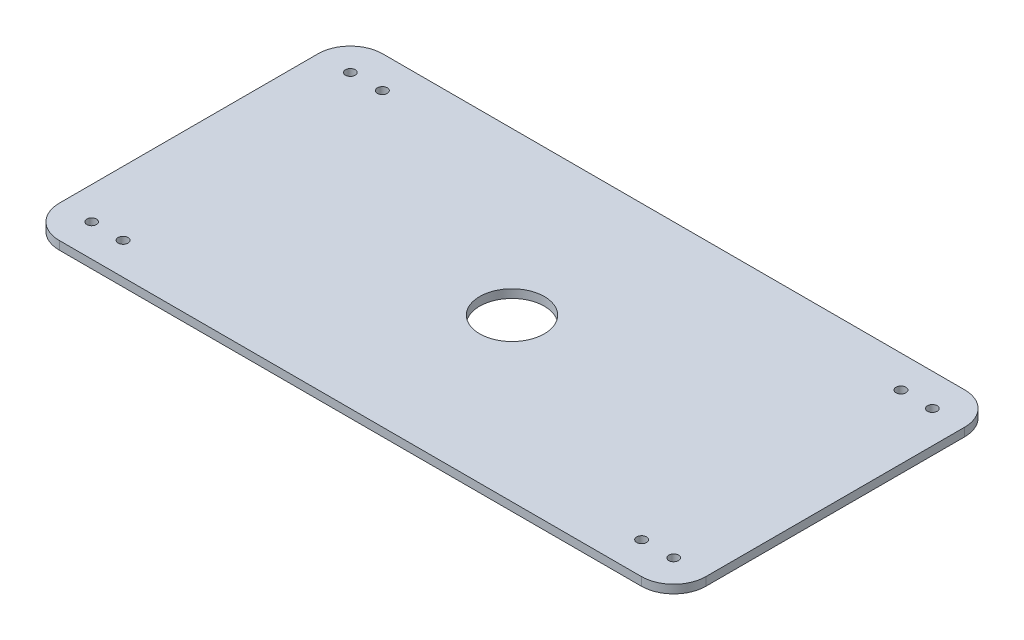
from build123d import *

# Parameters (mm, degrees)
SKETCH1_W               = 200
SKETCH1_H               = 100
BOSS_EXTRUDE1_DEPTH     = 2.6
FILLET1_R               = 10
SKETCH6_R               = 1.5
CUT_EXTRUDE6_DEPTH      = 2.6
MIRROR6_COPY_1_SKETCH_R = 1.5
MIRROR6_COPY_1_DEPTH    = 2.6
SKETCH15_R              = 10
CUT_EXTRUDE14_DEPTH     = 224.621913059
SKETCH23_R              = 1.524
CUT_EXTRUDE16_DEPTH     = 2.59999988
MIRROR8_COPY_1_SKETCH_R = 1.524
MIRROR8_COPY_1_DEPTH    = 2.59999988


with BuildPart() as part:
    # Sketch1 → Boss-Extrude1 (new body)
    with BuildSketch(Plane(origin=(0, 0, 0), x_dir=(1, 0, 0), z_dir=(0, 1, 0))):
        with Locations((100, -50)):
            Rectangle(SKETCH1_W, SKETCH1_H)
    extrude(amount=BOSS_EXTRUDE1_DEPTH)

    # Fillet1
    fillet1_edges = [part.edges().sort_by_distance(p)[0] for p in [
        (0, 1.3, 0),
        (200, 1.3, 0),
        (200, 1.3, 100),
        (0, 1.3, 100),
    ]]
    fillet(fillet1_edges, radius=FILLET1_R)

    # Sketch6 → Cut-Extrude6 (cut)
    with BuildSketch(Plane.XZ):
        with Locations(Location((190, 10, 0), (0, 0, 270))):
            Circle(SKETCH6_R)
    cut_extrude6 = extrude(amount=-CUT_EXTRUDE6_DEPTH, mode=Mode.SUBTRACT)

    # Mirror5: Cut-Extrude6 across plane
    add(cut_extrude6.mirror(Plane(origin=(100, 0, 0), x_dir=(0, 0, 1), z_dir=(1, 0, 0))), mode=Mode.SUBTRACT)

    # Mirror6: Cut-Extrude6 across plane
    add(cut_extrude6.mirror(Plane.XY.offset(50)), mode=Mode.SUBTRACT)

    # Mirror6 copy 1 sketch → Mirror6 copy 1 (cut)
    with BuildSketch(Plane(origin=(200, 0, 100), x_dir=(-1, 0, 0), z_dir=(0, -1, 0))):
        with Locations(Location((190, 10, 0), (0, 0, 270))):
            Circle(MIRROR6_COPY_1_SKETCH_R)
    extrude(amount=-MIRROR6_COPY_1_DEPTH, mode=Mode.SUBTRACT)

    # Sketch15 → Cut-Extrude14 (cut, through all)
    with BuildSketch(Plane.XZ):
        with Locations(Location((100, 50, 0), (0, 0, 270))):
            Circle(SKETCH15_R)
    extrude(amount=-CUT_EXTRUDE14_DEPTH, mode=Mode.SUBTRACT)

    # Sketch23 → Cut-Extrude16 (cut)
    with BuildSketch(Plane(origin=(0, 2.6, 0), x_dir=(1, 0, 0), z_dir=(0, 1, 0))):
        with Locations(Location((19.812, -9.906, 0), (0, 0, 270))):
            Circle(SKETCH23_R)
    cut_extrude16 = extrude(amount=-CUT_EXTRUDE16_DEPTH, mode=Mode.SUBTRACT)

    # Mirror7: Cut-Extrude16 across plane
    add(cut_extrude16.mirror(Plane(origin=(100, 0, 0), x_dir=(0, 0, 1), z_dir=(1, 0, 0))), mode=Mode.SUBTRACT)

    # Mirror8: Cut-Extrude16 across plane
    add(cut_extrude16.mirror(Plane.XY.offset(50)), mode=Mode.SUBTRACT)

    # Mirror8 copy 1 sketch → Mirror8 copy 1 (cut)
    with BuildSketch(Plane(origin=(200, 2.6, 100), x_dir=(-1, 0, 0), z_dir=(0, 1, 0))):
        with Locations(Location((19.812, -9.906, 0), (0, 0, 270))):
            Circle(MIRROR8_COPY_1_SKETCH_R)
    extrude(amount=-MIRROR8_COPY_1_DEPTH, mode=Mode.SUBTRACT)


solid = part.part
